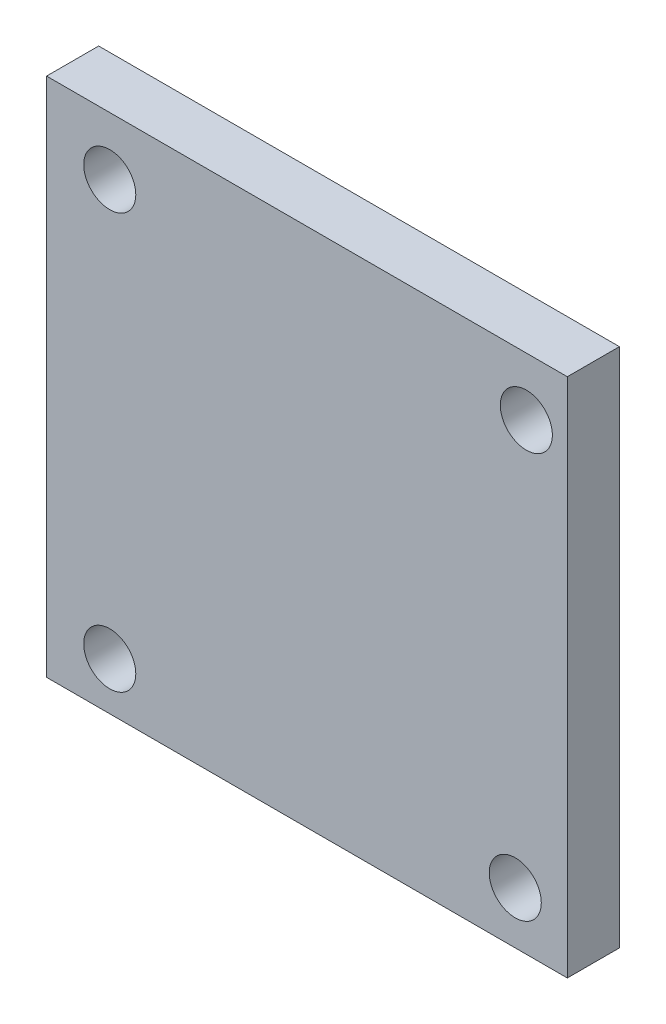
from build123d import *

# Parameters (mm, degrees)
SKETCH1_W           = 50
SKETCH1_H           = 50
SKETCH1_R           = 2.5
BOSS_EXTRUDE2_DEPTH = 5


with BuildPart() as part:
    # Sketch1 → Boss-Extrude2 (new body)
    with BuildSketch(Plane.XY):
        with Locations((-16.929421714, 3.134583643)):
            Rectangle(SKETCH1_W, SKETCH1_H)
        with Locations((-35.865331961, 22.556982127)):
            Circle(SKETCH1_R, mode=Mode.SUBTRACT)
        with Locations((4.134668039, 22.556982127)):
            Circle(SKETCH1_R, mode=Mode.SUBTRACT)
        with Locations((-35.865331961, -17.288520385)):
            Circle(SKETCH1_R, mode=Mode.SUBTRACT)
        with Locations((3.070578286, -16.865416357)):
            Circle(SKETCH1_R, mode=Mode.SUBTRACT)
    extrude(amount=BOSS_EXTRUDE2_DEPTH)


solid = part.part
